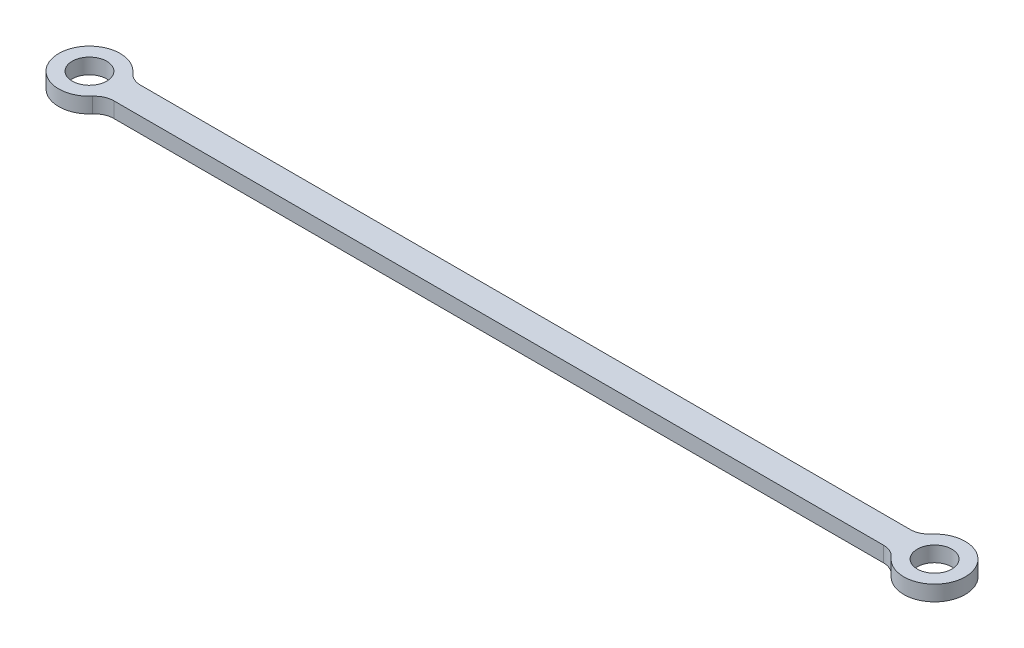
from build123d import *

# Parameters (mm, degrees)
SKETCH_1_R      = 4.5
EXTRUDE_1_DEPTH = 4


with BuildPart() as part:
    # 草图1 → 凸台-拉伸1 (new body)
    with BuildSketch(Plane(origin=(0, 0, 0), x_dir=(1, 0, 0), z_dir=(0, 1, 0))):
        with BuildLine():
            Line((-100.163842214, 3.5), (100.163842214, 3.5))
            ThreePointArc((100.163842214, 3.5), (102.243967949, 3.953234455), (103.946979824, 5.230769231))
            ThreePointArc((103.946979824, 5.230769231), (118, 0), (103.946979824, -5.230769231))
            ThreePointArc((103.946979824, -5.230769231), (102.243967949, -3.953234455), (100.163842214, -3.5))
            Line((100.163842214, -3.5), (-100.163842214, -3.5))
            ThreePointArc((-100.163842214, -3.5), (-102.243967949, -3.953234455), (-103.946979824, -5.230769231))
            ThreePointArc((-103.946979824, -5.230769231), (-118, 0), (-103.946979824, 5.230769231))
            ThreePointArc((-103.946979824, 5.230769231), (-102.243967949, 3.953234455), (-100.163842214, 3.5))
        make_face()
        with Locations(Location((110, 0, 0), (0, 0, 270))):
            Circle(SKETCH_1_R, mode=Mode.SUBTRACT)
        with Locations(Location((-110, 0, 0), (0, 0, 270))):
            Circle(SKETCH_1_R, mode=Mode.SUBTRACT)
    extrude(amount=EXTRUDE_1_DEPTH)


solid = part.part
